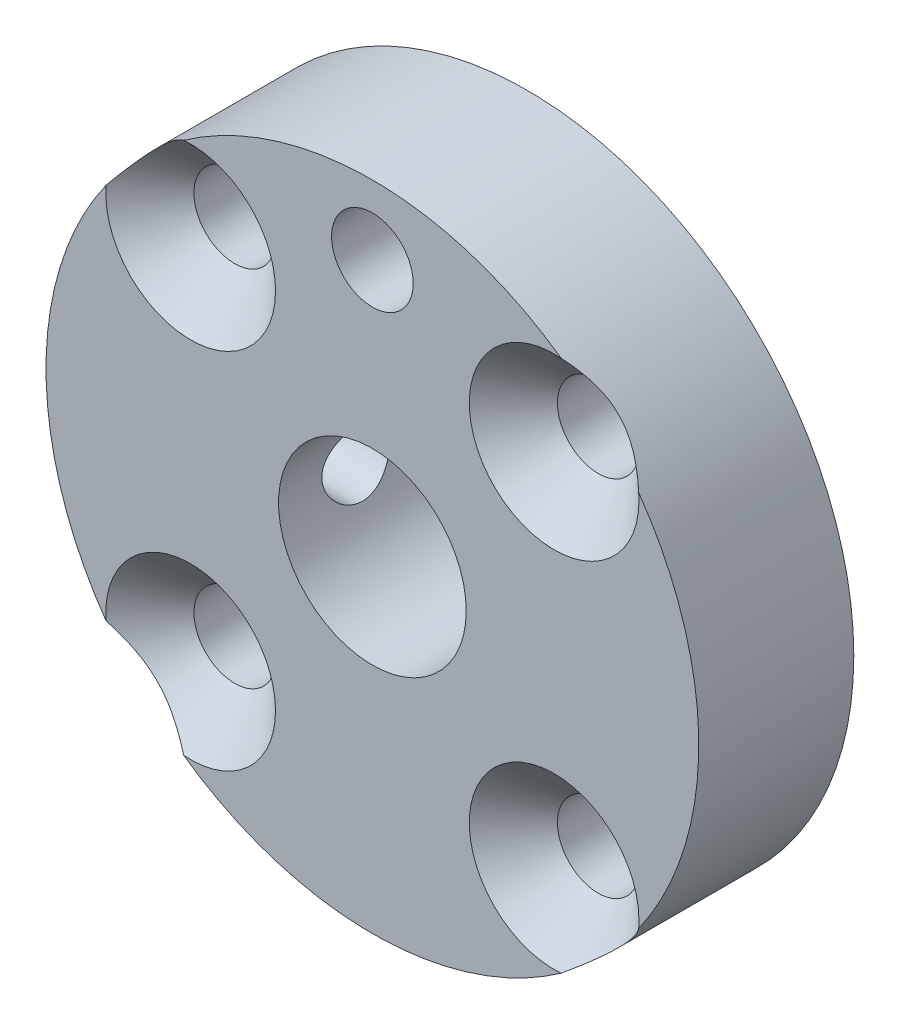
from build123d import *

# Parameters (mm, degrees)
SKETCH2_R                                       = 20
BOSS_EXTRUDE1_DEPTH                             = 9.5
CSK_FOR_M5_FLAT_HEAD_MACHINE_SCREW1_D           = 5
CSK_FOR_M5_FLAT_HEAD_MACHINE_SCREW1_CSINK_D     = 10.4
CSK_FOR_M5_FLAT_HEAD_MACHINE_SCREW1_CSINK_ANGLE = 90
SKETCH5_R                                       = 2.5
CUT_EXTRUDE1_DEPTH                              = 30.837057662
SKETCH6_R                                       = 5.75
CUT_EXTRUDE2_DEPTH                              = 30.837057662
SKETCH8_R                                       = 2.1
CUT_EXTRUDE3_DEPTH                              = 30.837057662


with BuildPart() as part:
    # Sketch2 → Boss-Extrude1 (new body)
    with BuildSketch(Plane.XY):
        Circle(SKETCH2_R)
    extrude(amount=BOSS_EXTRUDE1_DEPTH)

    # CSK for M5 Flat Head Machine Screw1 (through all)
    with Locations(Plane.XY.offset(9.5)):
        with Locations((-11.136931804, 11.136931804), (11.136931804, 11.136931804), (11.136931804, -11.136931804), (-11.136931804, -11.136931804)):
            CounterSinkHole(CSK_FOR_M5_FLAT_HEAD_MACHINE_SCREW1_D / 2, CSK_FOR_M5_FLAT_HEAD_MACHINE_SCREW1_CSINK_D / 2, counter_sink_angle=CSK_FOR_M5_FLAT_HEAD_MACHINE_SCREW1_CSINK_ANGLE)

    # Sketch5 → Cut-Extrude1 (cut, through all)
    with BuildSketch(Plane.XY.offset(9.5)):
        with Locations((0, 15.75)):
            Circle(SKETCH5_R)
    extrude(amount=-CUT_EXTRUDE1_DEPTH, mode=Mode.SUBTRACT)

    # Sketch6 → Cut-Extrude2 (cut, through all)
    with BuildSketch(Plane.XY.offset(9.5)):
        Circle(SKETCH6_R)
    extrude(amount=-CUT_EXTRUDE2_DEPTH, mode=Mode.SUBTRACT)

    # Sketch8 → Cut-Extrude3 (cut, through all)
    with BuildSketch(Plane(origin=(0, 0, 0), x_dir=(0, 0, -1), z_dir=(1, 0, 0))):
        with Locations((-4.75, 0)):
            Circle(SKETCH8_R)
    extrude(amount=-CUT_EXTRUDE3_DEPTH, mode=Mode.SUBTRACT)


solid = part.part
